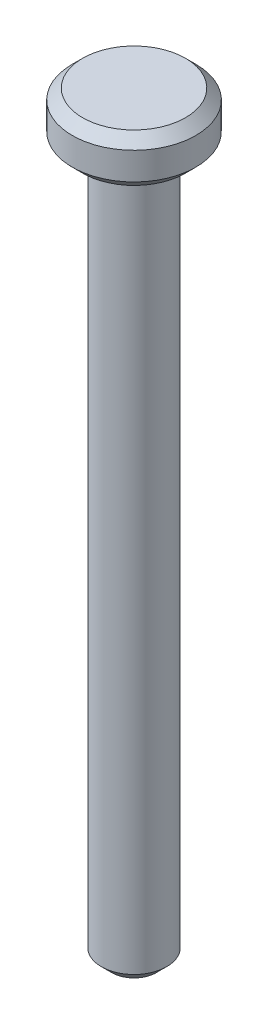
from build123d import *


with BuildPart() as part:
    # Sketch1 → Revolve1 (revolve)
    with BuildSketch(Plane(origin=(0, 0, 0), x_dir=(0, 0, -1), z_dir=(1, 0, 0))):
        Polygon((0, 0), (3.2625, 0), (4.7625, 1.5), (4.7625, 101.5), (6.2625, 103), (7.5, 103), (9, 104.5), (9, 108.5), (7.5, 110), (0, 110), align=None)
    revolve(axis=Axis((0, 0, 0), (0, 1, 0)))


solid = part.part
